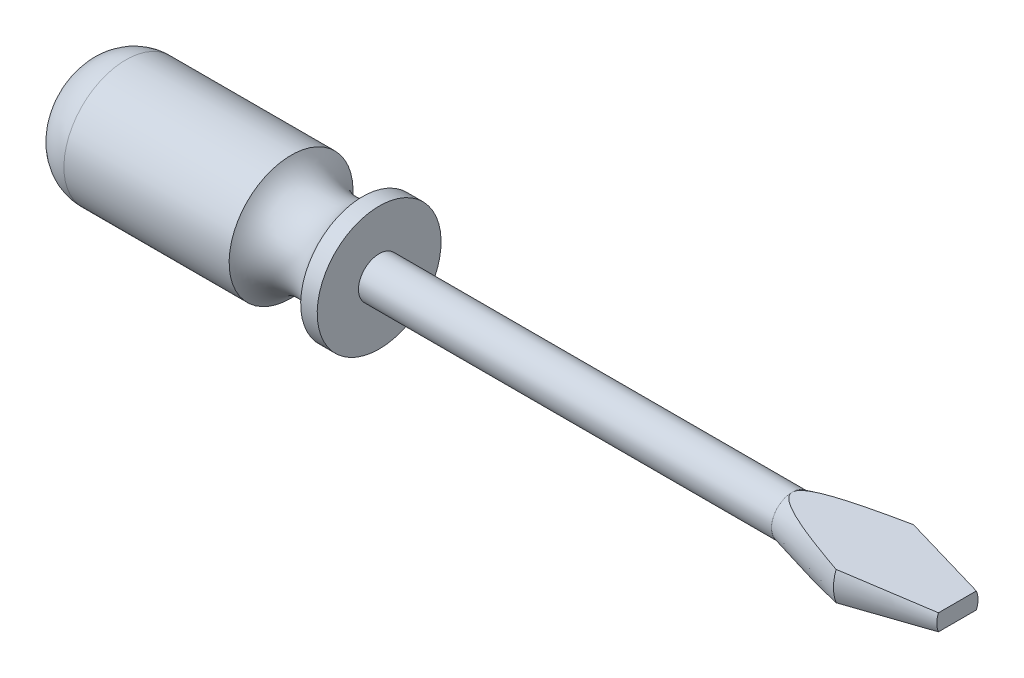
from build123d import *

# Parameters (mm, degrees)
CUT_EXTRUDE2_DEPTH = 25.4


with BuildPart() as part:
    # Sketch1 → Revolve6 (revolve)
    with BuildSketch(Plane.XY, mode=Mode.PRIVATE) as revolve6_sk:
        with BuildLine():
            Line((6.927857085, 8.89), (57.727857085, 8.89))
            ThreePointArc((57.727857085, 8.89), (68.726379713, 2.54), (79.724902341, 8.89))
            Line((79.724902341, 8.89), (84.804902341, 8.89))
            Line((84.804902341, 8.89), (84.804902341, -3.81))
            Line((84.804902341, -3.81), (211.804902341, -3.81))
            Line((211.804902341, -3.81), (237.204902341, 2.54))
            Line((237.204902341, 2.54), (262.604902341, -3.81))
            Line((262.604902341, -3.81), (262.604902341, -10.16))
            Line((262.604902341, -10.16), (-5.206352051, -10.16))
            ThreePointArc((-5.206352051, -10.16), (-4.365299375, 2.693819245), (6.927857085, 8.89))
        make_face()
    revolve(revolve6_sk.sketch.rotate(Axis((-5.206352051, -10.16, 0), (1, 0, 0)), 180), axis=Axis((-5.206352051, -10.16, 0), (1, 0, 0)))

    # Sketch3 → Cut-Extrude2 (cut, symmetric)
    with BuildSketch(Plane.XY):
        Polygon((211.804902341, -3.81), (262.604902341, -7.62), (262.604902341, 19.982961782), (211.804902341, 19.982961782), align=None)
        Polygon((262.604902341, -40.302961782), (262.604902341, -12.7), (211.804902341, -16.51), (211.804902341, -40.302961782), align=None)
    extrude(amount=CUT_EXTRUDE2_DEPTH, both=True, mode=Mode.SUBTRACT)


solid = part.part
